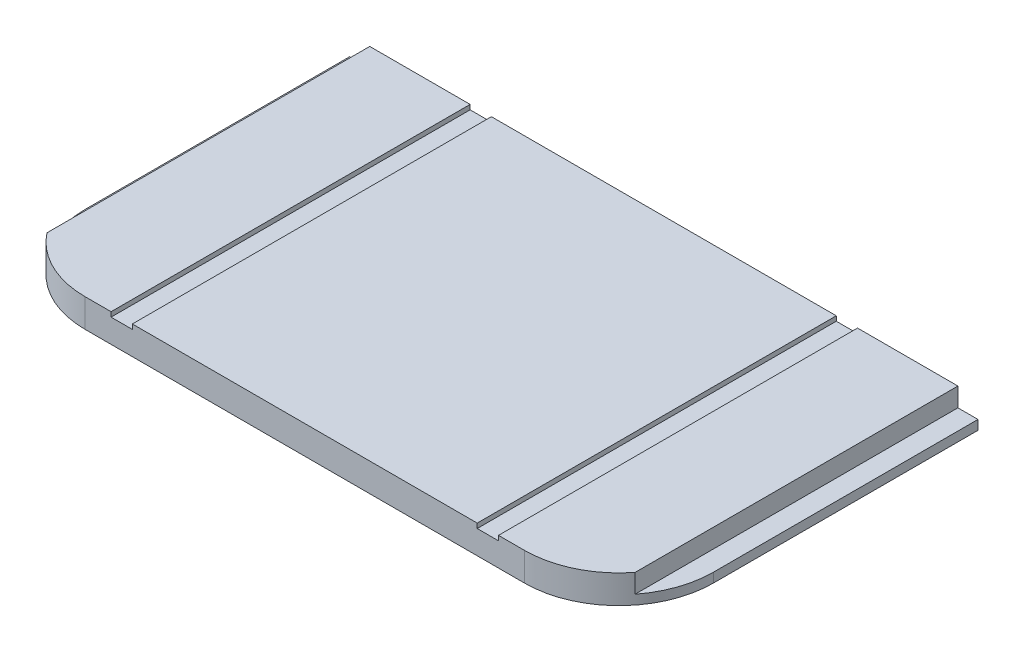
from build123d import *

# Parameters (mm, degrees)
SKETCH1_W           = 422.275
SKETCH1_H           = 241.3
BOSS_EXTRUDE1_DEPTH = 19.05
CUT_EXTRUDE1_REACH  = 323.197
SKETCH2_W           = 13.49375
SKETCH2_H           = 3.175
SKETCH2_W_2         = 14.2875
FILLET1_R           = 63.5
CUT_EXTRUDE2_REACH  = 323.197
SKETCH3_W           = 13.49375
SKETCH3_H           = 9.525


with BuildPart() as part:
    # Sketch1 → Boss-Extrude1 (new body)
    with BuildSketch(Plane(origin=(0, 0, 0), x_dir=(1, 0, 0), z_dir=(0, 1, 0))):
        Rectangle(SKETCH1_W, SKETCH1_H)
    extrude(amount=BOSS_EXTRUDE1_DEPTH)

    # Sketch2 → Cut-Extrude1 (cut, up to next)
    with BuildSketch(Plane.XY.offset(120.65), mode=Mode.PRIVATE) as cut_extrude1_sk1:
        with Locations((-204.390625, 17.4625)):
            Rectangle(SKETCH2_W, SKETCH2_H)
    cut_extrude1_tool1 = extrude(cut_extrude1_sk1.sketch, amount=-CUT_EXTRUDE1_REACH, mode=Mode.PRIVATE) & part.part
    # Sketch2 → Cut-Extrude1 (cut, up to next)
    with BuildSketch(Plane.XY.offset(120.65), mode=Mode.PRIVATE) as cut_extrude1_sk2:
        with Locations((-123.03125, 17.4625)):
            Rectangle(SKETCH2_W_2, SKETCH2_H)
    cut_extrude1_tool2 = extrude(cut_extrude1_sk2.sketch, amount=-CUT_EXTRUDE1_REACH, mode=Mode.PRIVATE) & part.part
    # Sketch2 → Cut-Extrude1 (cut, up to next)
    with BuildSketch(Plane.XY.offset(120.65), mode=Mode.PRIVATE) as cut_extrude1_sk3:
        with Locations((123.03125, 17.4625)):
            Rectangle(SKETCH2_W_2, SKETCH2_H)
    cut_extrude1_tool3 = extrude(cut_extrude1_sk3.sketch, amount=-CUT_EXTRUDE1_REACH, mode=Mode.PRIVATE) & part.part
    # Sketch2 → Cut-Extrude1 (cut, up to next)
    with BuildSketch(Plane.XY.offset(120.65), mode=Mode.PRIVATE) as cut_extrude1_sk4:
        with Locations((204.390625, 17.4625)):
            Rectangle(SKETCH2_W, SKETCH2_H)
    cut_extrude1_tool4 = extrude(cut_extrude1_sk4.sketch, amount=-CUT_EXTRUDE1_REACH, mode=Mode.PRIVATE) & part.part
    add(cut_extrude1_tool1.solids().sort_by_distance((-204.390625, 17.4625, 120.65))[0], mode=Mode.SUBTRACT)
    add(cut_extrude1_tool2.solids().sort_by_distance((-123.03125, 17.4625, 120.65))[0], mode=Mode.SUBTRACT)
    add(cut_extrude1_tool3.solids().sort_by_distance((123.03125, 17.4625, 120.65))[0], mode=Mode.SUBTRACT)
    add(cut_extrude1_tool4.solids().sort_by_distance((204.390625, 17.4625, 120.65))[0], mode=Mode.SUBTRACT)

    # Fillet1
    fillet1_edges = [part.edges().sort_by_distance(p)[0] for p in [
        (211.1375, 7.9375, 120.65),
        (-211.1375, 7.9375, 120.65),
    ]]
    fillet(fillet1_edges, radius=FILLET1_R)

    # Sketch3 → Cut-Extrude2 (cut, up to next)
    with BuildSketch(Plane(origin=(0, 0, -120.65), x_dir=(-1, 0, 0), z_dir=(0, 0, -1)), mode=Mode.PRIVATE) as cut_extrude2_sk1:
        with Locations((-204.390625, 11.1125)):
            Rectangle(SKETCH3_W, SKETCH3_H)
    cut_extrude2_tool1 = extrude(cut_extrude2_sk1.sketch, amount=-CUT_EXTRUDE2_REACH, mode=Mode.PRIVATE) & part.part
    # Sketch3 → Cut-Extrude2 (cut, up to next)
    with BuildSketch(Plane(origin=(0, 0, -120.65), x_dir=(-1, 0, 0), z_dir=(0, 0, -1)), mode=Mode.PRIVATE) as cut_extrude2_sk2:
        with Locations((204.390625, 11.1125)):
            Rectangle(SKETCH3_W, SKETCH3_H)
    cut_extrude2_tool2 = extrude(cut_extrude2_sk2.sketch, amount=-CUT_EXTRUDE2_REACH, mode=Mode.PRIVATE) & part.part
    add(cut_extrude2_tool1.solids().sort_by_distance((204.390625, 11.1125, -120.65))[0], mode=Mode.SUBTRACT)
    add(cut_extrude2_tool2.solids().sort_by_distance((-204.390625, 11.1125, -120.65))[0], mode=Mode.SUBTRACT)


solid = part.part
